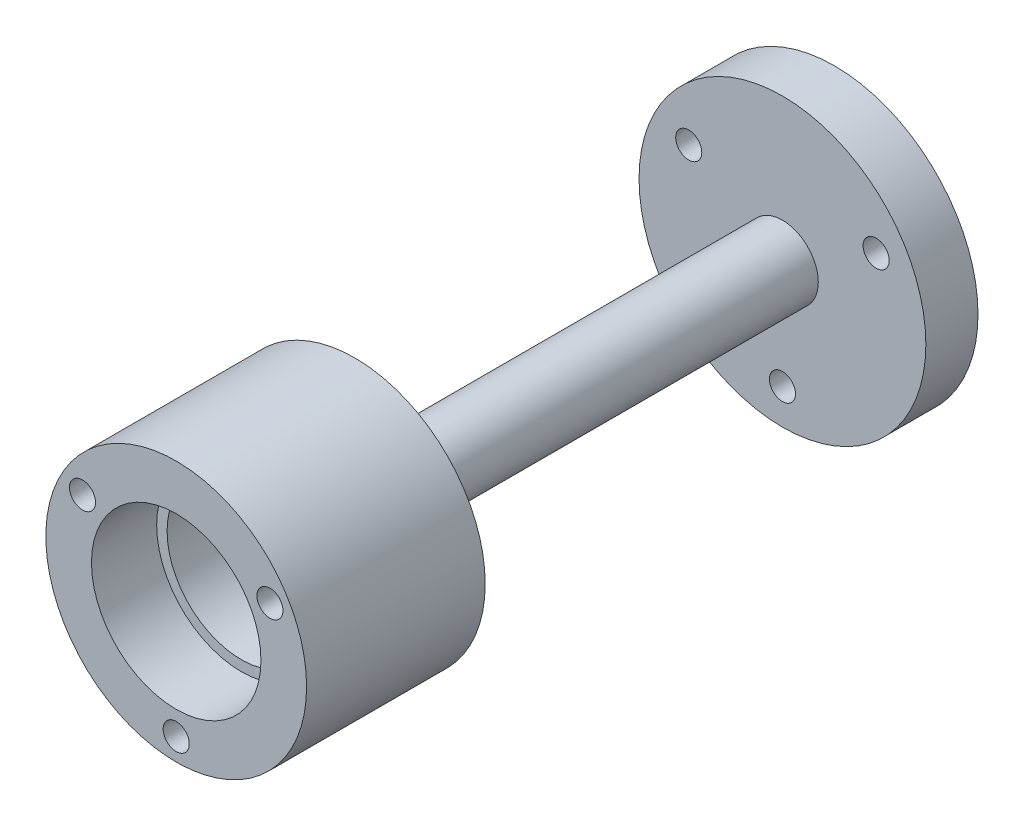
from build123d import *

# Parameters (mm, degrees)
MOUNTING_FLANGE_START                          = -4
SKETCH1_R                                      = 11
MOUNTING_FLANGE_DEPTH                          = 4
SKETCH2_R                                      = 2.75
D5P5_CENTRAL_POST_DEPTH                        = 32.81
CLOSED_FLOOR_BELOW_SHAFT_NOSE_START            = 32.8
SKETCH3_R                                      = 10
CLOSED_FLOOR_BELOW_SHAFT_NOSE_DEPTH            = 2.2
SHAFT_AND_CLIP_CLEARANCE_START                 = 35
SKETCH4_R                                      = 10
SKETCH4_R_2                                    = 5.7
SHAFT_AND_CLIP_CLEARANCE_DEPTH                 = 6.5
LOWER_686ZZ_SEAT_START                         = 41.5
SKETCH5_R                                      = 10
SKETCH5_R_2                                    = 6.5
LOWER_686ZZ_SEAT_DEPTH                         = 5
SKETCH6_R                                      = 1
BASE_THREE_M2_THROUGH_THREAD_MAJOR_ENVEL_DEPTH = 4.01
TOP_CAP_THREE_M2_BLIND_THREAD_MAJOR_ENVE_START = -4.3
SKETCH7_R                                      = 1
TOP_CAP_THREE_M2_BLIND_THREAD_MAJOR_ENVE_DEPTH = 4.3


with BuildPart() as part:
    # Sketch1 → Mounting_Flange (new body)
    with BuildSketch(Plane.XY.offset(MOUNTING_FLANGE_START)):
        Circle(SKETCH1_R)
    extrude(amount=MOUNTING_FLANGE_DEPTH)

    # Sketch2 → D5p5_Central_Post (add)
    with BuildSketch(Plane.XY):
        Circle(SKETCH2_R)
    extrude(amount=D5P5_CENTRAL_POST_DEPTH)

    # Sketch3 → Closed_Floor_Below_Shaft_Nose (add)
    with BuildSketch(Plane.XY.offset(CLOSED_FLOOR_BELOW_SHAFT_NOSE_START)):
        Circle(SKETCH3_R)
    extrude(amount=CLOSED_FLOOR_BELOW_SHAFT_NOSE_DEPTH)

    # Sketch4 → Shaft_And_Clip_Clearance (add)
    with BuildSketch(Plane.XY.offset(SHAFT_AND_CLIP_CLEARANCE_START)):
        Circle(SKETCH4_R)
        with Locations(Location((0, 0, 0), (0, 0, 180))):
            Circle(SKETCH4_R_2, mode=Mode.SUBTRACT)
    extrude(amount=SHAFT_AND_CLIP_CLEARANCE_DEPTH)

    # Sketch5 → Lower_686ZZ_Seat (add)
    with BuildSketch(Plane.XY.offset(LOWER_686ZZ_SEAT_START)):
        Circle(SKETCH5_R)
        Circle(SKETCH5_R_2, mode=Mode.SUBTRACT)
    extrude(amount=LOWER_686ZZ_SEAT_DEPTH)

    # Sketch6 → Base_Three_M2_Through_Thread_Major_Envelopes (cut)
    with BuildSketch(Plane(origin=(0, 0, -4), x_dir=(-1, 0, 0), z_dir=(0, 0, -1))):
        with Locations((-7.188010851, 4.15)):
            Circle(SKETCH6_R)
        with Locations((7.188010851, 4.15)):
            Circle(SKETCH6_R)
        with Locations((0, -8.3)):
            Circle(SKETCH6_R)
    extrude(amount=-BASE_THREE_M2_THROUGH_THREAD_MAJOR_ENVEL_DEPTH, mode=Mode.SUBTRACT)

    # Sketch7 → Top_Cap_Three_M2_Blind_Thread_Major_Envelopes (cut)
    with BuildSketch(Plane.XY.offset(46.5).offset(TOP_CAP_THREE_M2_BLIND_THREAD_MAJOR_ENVE_START)):
        with Locations(Location((7.188010851, 4.15, 0), (0, 0, 180))):
            Circle(SKETCH7_R)
        with Locations(Location((-7.188010851, 4.15, 0), (0, 0, 180))):
            Circle(SKETCH7_R)
        with Locations(Location((0, -8.3, 0), (0, 0, 180))):
            Circle(SKETCH7_R)
    extrude(amount=TOP_CAP_THREE_M2_BLIND_THREAD_MAJOR_ENVE_DEPTH, mode=Mode.SUBTRACT)


solid = part.part
